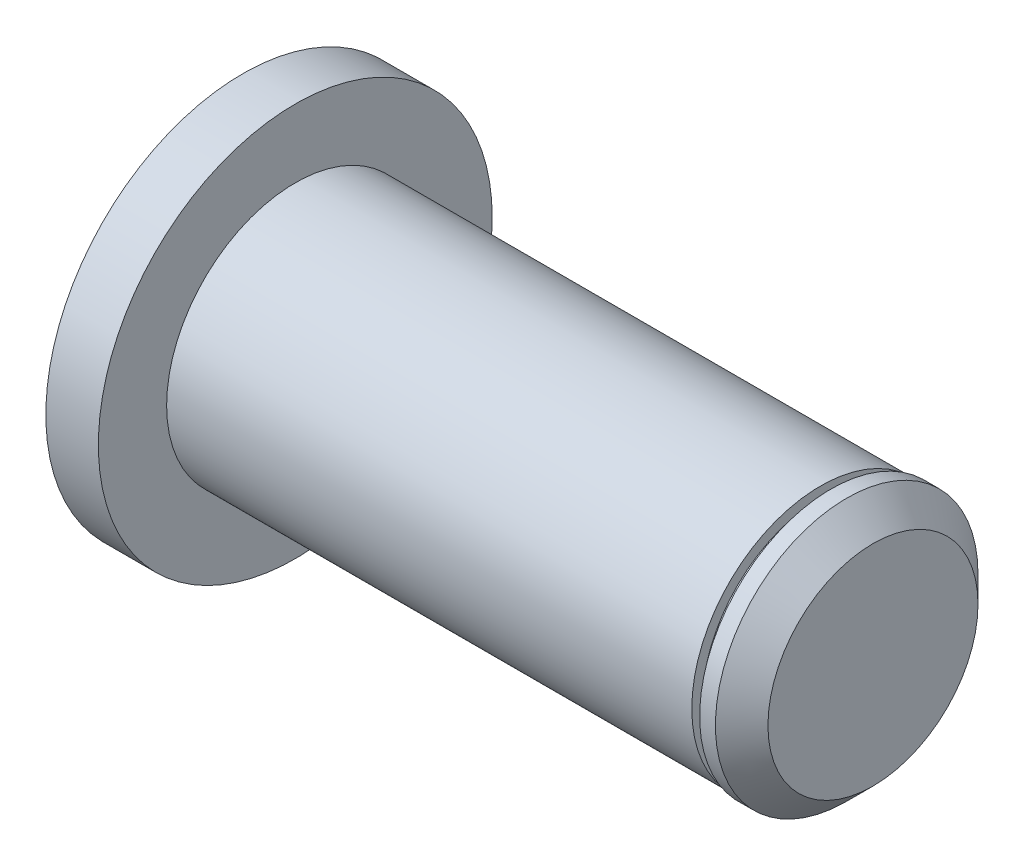
from build123d import *

# Parameters (mm, degrees)
SKETCH1_R          = 37.5
EXTRUDE1_DEPTH     = 10
SKETCH2_R          = 24.5
EXTRUDE2_DEPTH     = 110
SKETCH3_OUTSIDE_W  = 109.032
SKETCH3_OUTSIDE_H  = 109.032
SKETCH3_OUTSIDE_R  = 22.5
CUT_EXTRUDE1_DEPTH = 10
SKETCH4_R          = 25
EXTRUDE3_DEPTH     = 8
CHAMFER1_SIZE      = 5


with BuildPart() as part:
    # Sketch1 → Extrude1 (new body)
    with BuildSketch(Plane(origin=(0, 0, 0), x_dir=(0, 0, -1), z_dir=(1, 0, 0))):
        Circle(SKETCH1_R)
    extrude(amount=EXTRUDE1_DEPTH)

    # Sketch2 → Extrude2 (add)
    with BuildSketch(Plane(origin=(10, 0, 0), x_dir=(0, 0, -1), z_dir=(1, 0, 0))):
        Circle(SKETCH2_R)
    extrude(amount=EXTRUDE2_DEPTH)

    # Sketch3 outside → Cut-Extrude1 (cut)
    with BuildSketch(Plane(origin=(120, 0, 0), x_dir=(0, 0, -1), z_dir=(1, 0, 0))):
        Rectangle(SKETCH3_OUTSIDE_W, SKETCH3_OUTSIDE_H)
        Circle(SKETCH3_OUTSIDE_R, mode=Mode.SUBTRACT)
    extrude(amount=-CUT_EXTRUDE1_DEPTH, mode=Mode.SUBTRACT)

    # Sketch4 → Extrude3 (add)
    with BuildSketch(Plane(origin=(120, 0, 0), x_dir=(0, 0, -1), z_dir=(1, 0, 0))):
        Circle(SKETCH4_R)
    extrude(amount=-EXTRUDE3_DEPTH)

    # Chamfer1
    chamfer1_edges = [part.edges().sort_by_distance(p)[0] for p in [
        (120, 0, 25),
    ]]
    chamfer(chamfer1_edges, length=CHAMFER1_SIZE)


solid = part.part
